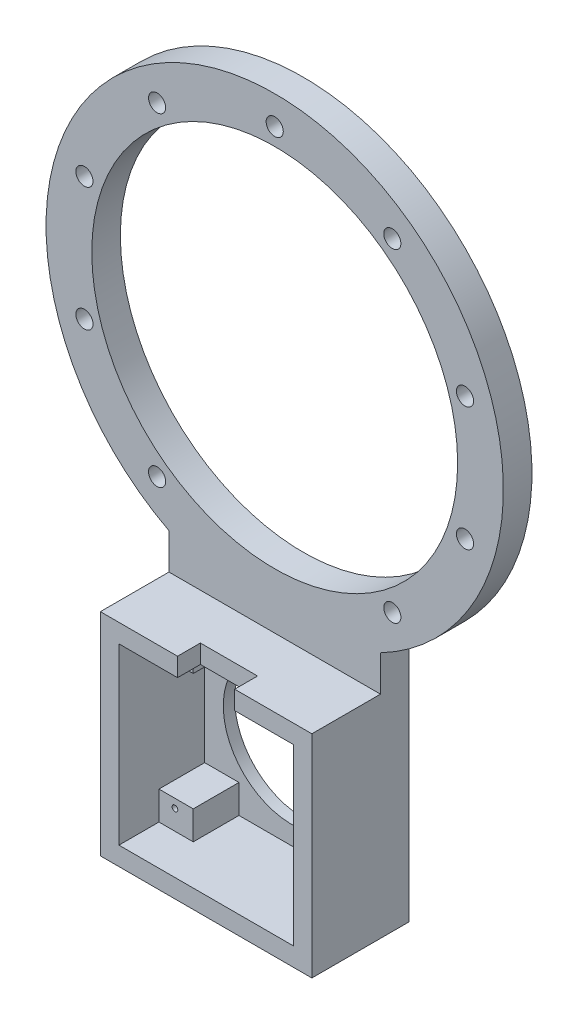
from build123d import *

# Parameters (mm, degrees)
SKETCH1_R           = 1.5
SKETCH1_R_2         = 32
BOSS_EXTRUDE1_DEPTH = 5
SKETCH1_31_R        = 12
BOSS_EXTRUDE2_DEPTH = 2
SKETCH1_32_W        = 6
SKETCH1_32_H        = 5
SKETCH1_32_R        = 0.5
BOSS_EXTRUDE3_DEPTH = 10
SKETCH1_33_W        = 37
SKETCH1_33_H        = 37
BOSS_EXTRUDE4_DEPTH = 17
SKETCH2_W           = 10
SKETCH2_H           = 4
CUT_EXTRUDE1_DEPTH  = 3.25


with BuildPart() as part:
    # Sketch1 → Boss-Extrude1 (new body)
    with BuildSketch(Plane.XY):
        with BuildLine():
            Line((-18.5, -41.733467654), (18.5, -41.733467654))
            Line((18.5, -41.733467654), (18.5, -35.464771253))
            ThreePointArc((18.5, -35.464771253), (0, 40), (-18.5, -35.464771253))
            Line((-18.5, -35.464771253), (-18.5, -41.733467654))
        make_face()
        with Locations((-20.57248383, -28.315594803)):
            Circle(SKETCH1_R, mode=Mode.SUBTRACT)
        with Locations((20.57248383, -28.315594803)):
            Circle(SKETCH1_R, mode=Mode.SUBTRACT)
        with Locations((-33.28697807, -10.815594803)):
            Circle(SKETCH1_R, mode=Mode.SUBTRACT)
        with Locations((-33.28697807, 10.815594803)):
            Circle(SKETCH1_R, mode=Mode.SUBTRACT)
        with Locations((-20.57248383, 28.315594803)):
            Circle(SKETCH1_R, mode=Mode.SUBTRACT)
        Circle(SKETCH1_R_2, mode=Mode.SUBTRACT)
        with Locations((33.28697807, -10.815594803)):
            Circle(SKETCH1_R, mode=Mode.SUBTRACT)
        with Locations((0, 35)):
            Circle(SKETCH1_R, mode=Mode.SUBTRACT)
        with Locations((33.28697807, 10.815594803)):
            Circle(SKETCH1_R, mode=Mode.SUBTRACT)
        with Locations((20.57248383, 28.315594803)):
            Circle(SKETCH1_R, mode=Mode.SUBTRACT)
    extrude(amount=BOSS_EXTRUDE1_DEPTH)



with BuildPart() as body_2:
    # Sketch1<31> → Boss-Extrude2 (new body)
    with BuildSketch(Plane.XY):
        Polygon((9.25, -49.983467654), (9.25, -44.983467654), (-9.25, -44.983467654), (-9.25, -49.983467654), (-15.25, -49.983467654), (-15.25, -70.483467654), (-9.25, -70.483467654), (-9.25, -75.483467654), (9.25, -75.483467654), (9.25, -70.483467654), (15.25, -70.483467654), (15.25, -49.983467654), align=None)
        with Locations((0, -60.233467654)):
            Circle(SKETCH1_31_R, mode=Mode.SUBTRACT)
    extrude(amount=BOSS_EXTRUDE2_DEPTH)

    # Sketch1<32> → Boss-Extrude3 (add)
    # profile 1 of 4: a face of its own
    with BuildSketch(Plane.XY):
        with Locations((-12.25, -47.483467654)):
            Rectangle(SKETCH1_32_W, SKETCH1_32_H)
        with Locations((-12.45, -48.456490694)):
            Circle(SKETCH1_32_R, mode=Mode.SUBTRACT)
    # profile 2 of 4: a face of its own
    with BuildSketch(Plane.XY):
        with Locations((12.25, -47.483467654)):
            Rectangle(SKETCH1_32_W, SKETCH1_32_H)
        with Locations((12.45, -48.456490694)):
            Circle(SKETCH1_32_R, mode=Mode.SUBTRACT)
    # profile 3 of 4: a face of its own
    with BuildSketch(Plane.XY):
        with Locations((12.25, -72.983467654)):
            Rectangle(SKETCH1_32_W, SKETCH1_32_H)
        with Locations((12.45, -72.010444613)):
            Circle(SKETCH1_32_R, mode=Mode.SUBTRACT)
    # profile 4 of 4: a face of its own
    with BuildSketch(Plane.XY):
        with Locations((-12.25, -72.983467654)):
            Rectangle(SKETCH1_32_W, SKETCH1_32_H)
        with Locations((-12.45, -72.010444613)):
            Circle(SKETCH1_32_R, mode=Mode.SUBTRACT)
    extrude(amount=BOSS_EXTRUDE3_DEPTH)


with BuildPart() as part_1:
    add(part.part)

    add(body_2.part)  # Boss-Extrude4 merges body 2
    # Sketch1<33> → Boss-Extrude4 (add)
    with BuildSketch(Plane.XY):
        with Locations((0, -60.233467654)):
            Rectangle(SKETCH1_33_W, SKETCH1_33_H)
        Polygon((9.25, -44.983467654), (15.25, -44.983467654), (15.25, -49.983467654), (15.25, -70.483467654), (15.25, -75.483467654), (9.25, -75.483467654), (-9.25, -75.483467654), (-15.25, -75.483467654), (-15.25, -70.483467654), (-15.25, -49.983467654), (-15.25, -44.983467654), (-9.25, -44.983467654), align=None, mode=Mode.SUBTRACT)
    extrude(amount=BOSS_EXTRUDE4_DEPTH)

    # Sketch2 → Cut-Extrude1 (cut)
    with BuildSketch(Plane.XZ.offset(44.983467654)):
        with Locations((0, 15)):
            Rectangle(SKETCH2_W, SKETCH2_H)
    extrude(amount=-CUT_EXTRUDE1_DEPTH, mode=Mode.SUBTRACT)


solid = part_1.part
